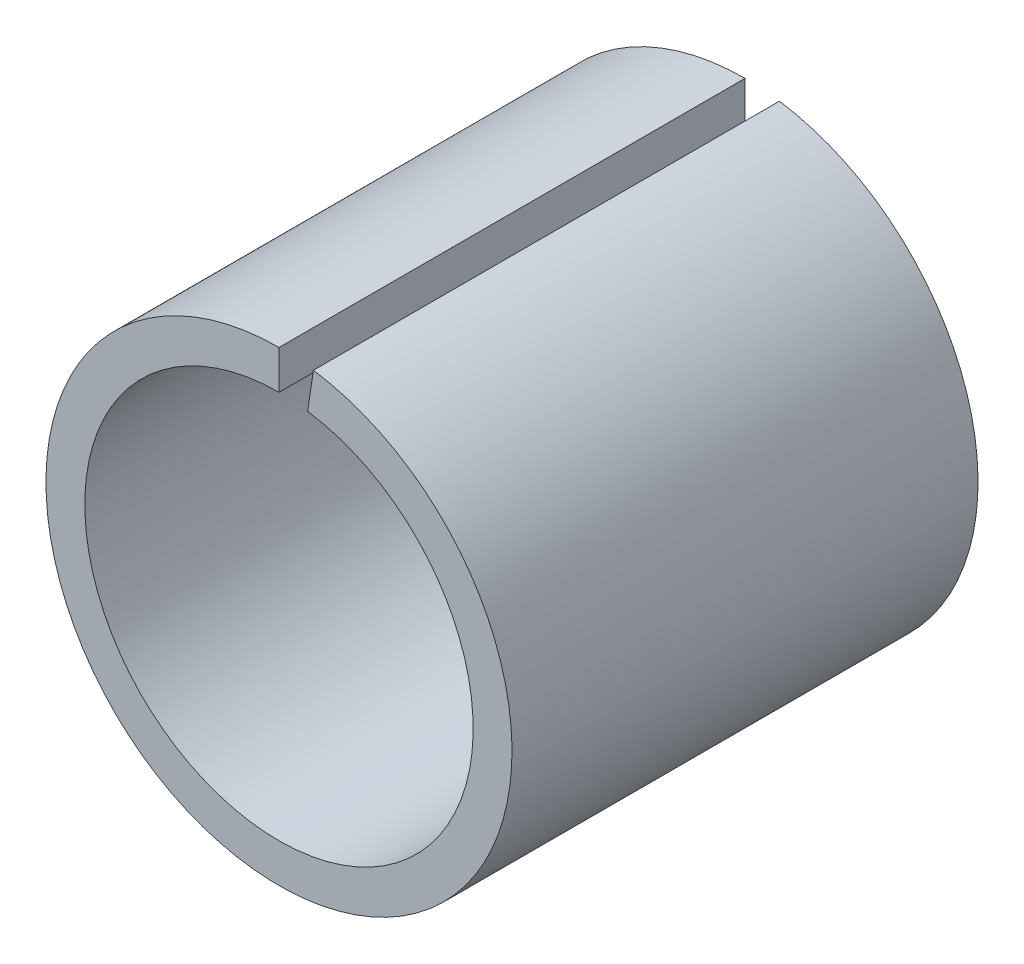
from build123d import *

# Parameters (mm, degrees)
SKETCH_1_R          = 6
SKETCH_1_R_2        = 5
EXTRUDE_1_DEPTH     = 12
CUT_EXTRUDE_1_DEPTH = 20


with BuildPart() as part:
    # 草图1 → 凸台-拉伸1 (new body)
    with BuildSketch(Plane.XY):
        Circle(SKETCH_1_R)
        Circle(SKETCH_1_R_2, mode=Mode.SUBTRACT)
    extrude(amount=EXTRUDE_1_DEPTH)

    # 草图2 → 切除-拉伸1 (cut)
    with BuildSketch(Plane.XY.offset(12)):
        Polygon((0, 0), (0, 6), (1.720906164, 11.533635692), align=None)
    extrude(amount=-CUT_EXTRUDE_1_DEPTH, mode=Mode.SUBTRACT)


solid = part.part
